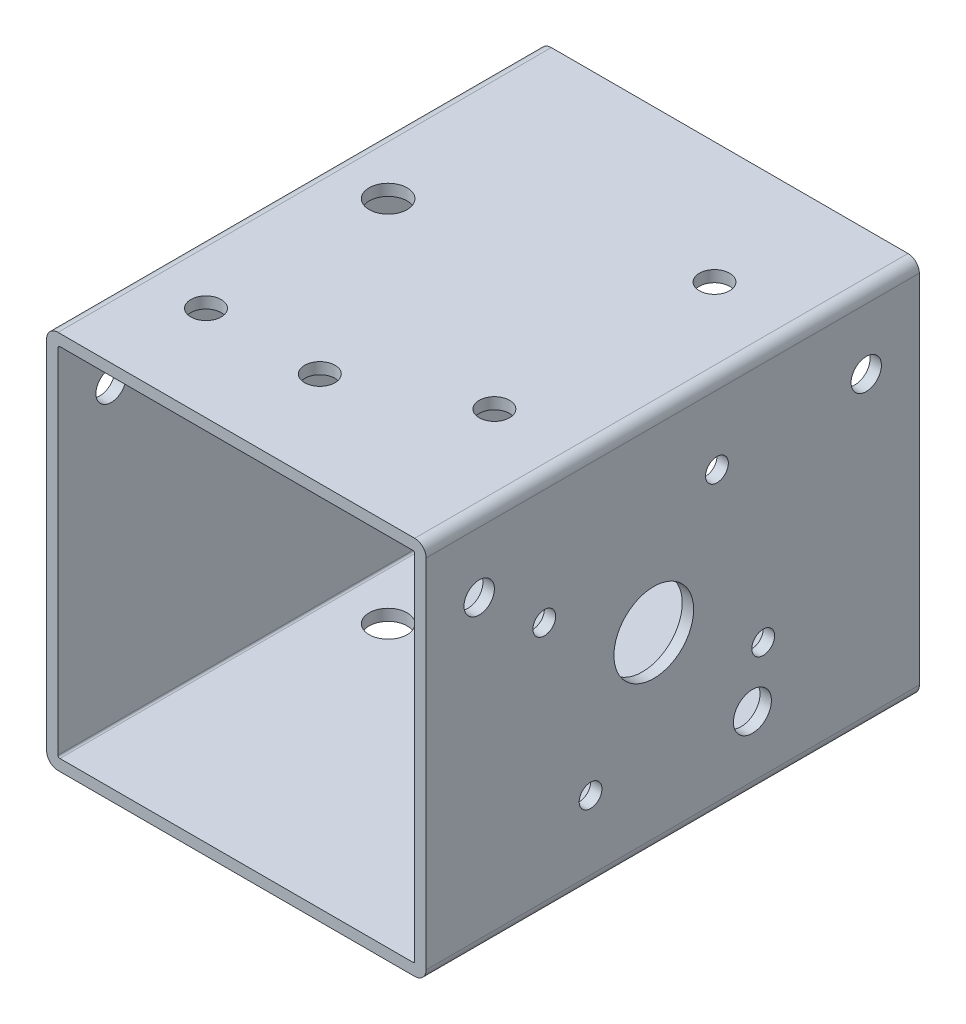
from build123d import *

# Parameters (mm, degrees)
SKETCH1_W                      = 100
SKETCH1_H                      = 100
SKETCH1_W_2                    = 94
SKETCH1_H_2                    = 94
EXTRUDE_THIN1_DEPTH            = 130
FILLET1_R                      = 0.5
FILLET2_R                      = 3
F_8_0_8_DIAMETER_HOLE2_D       = 8
F_8_0_8_DIAMETER_HOLE3_D       = 8
F_10_0_10_DIAMETER_HOLE1_D     = 10
F_10_0_10_DIAMETER_HOLE2_D     = 10
M8X1_25_TAPPED_HOLE1_D         = 6.8
M8X1_25_TAPPED_HOLE1_DEPTH     = 3
M8X1_25_TAPPED_HOLE2_D         = 6.8
M8X1_25_TAPPED_HOLE2_DEPTH     = 3
F_21_0_21_DIAMETER_HOLE1_D     = 21
F_21_0_21_DIAMETER_HOLE1_DEPTH = 3
F_6_0_6_DIAMETER_HOLE1_D       = 6
F_6_0_6_DIAMETER_HOLE1_DEPTH   = 3
F_8_0_8_DIAMETER_HOLE4_D       = 8
F_8_0_8_DIAMETER_HOLE4_DEPTH   = 3
SKETCH33_R                     = 4
CUT_EXTRUDE1_DEPTH             = 10


with BuildPart() as part:
    # Sketch1 → Extrude-Thin1 (new body)
    with BuildSketch(Plane.XY):
        Rectangle(SKETCH1_W, SKETCH1_H)
        Rectangle(SKETCH1_W_2, SKETCH1_H_2, mode=Mode.SUBTRACT)
    extrude(amount=EXTRUDE_THIN1_DEPTH)

    # Fillet1
    fillet1_edges = [part.edges().sort_by_distance(p)[0] for p in [
        (47, -47, 65),
        (47, 47, 65),
        (-47, 47, 65),
        (-47, -47, 65),
    ]]
    fillet(fillet1_edges, radius=FILLET1_R)

    # Fillet2
    fillet2_edges = [part.edges().sort_by_distance(p)[0] for p in [
        (50, -50, 65),
        (-50, -50, 65),
        (-50, 50, 65),
        (50, 50, 65),
    ]]
    fillet(fillet2_edges, radius=FILLET2_R)

    # Ø8.0 (8) Diameter Hole2 (through all)
    with Locations(Plane(origin=(0, 50, 0), x_dir=(1, 0, 0), z_dir=(0, 1, 0))):
        with Locations((28, -32), (28, -90)):
            Hole(F_8_0_8_DIAMETER_HOLE2_D / 2)

    # Ø8.0 (8) Diameter Hole3 (through all)
    with Locations(Plane(origin=(50, 0, 0), x_dir=(0, 0, -1), z_dir=(1, 0, 0))):
        with Locations((-14, 31), (-116, 31)):
            Hole(F_8_0_8_DIAMETER_HOLE3_D / 2)

    # Ø10.0 (10) Diameter Hole1 (through all)
    with Locations(Plane(origin=(0, 50, 0), x_dir=(1, 0, 0), z_dir=(0, 1, 0))):
        with Locations((-34, -56)):
            Hole(F_10_0_10_DIAMETER_HOLE1_D / 2)

    # Ø10.0 (10) Diameter Hole2 (through all)
    with Locations(Plane(origin=(50, 0, 0), x_dir=(0, 0, -1), z_dir=(1, 0, 0))):
        with Locations((-44, -31)):
            Hole(F_10_0_10_DIAMETER_HOLE2_D / 2)

    # M8x1.25 Tapped Hole1
    with Locations(Plane.ZY.offset(50)):
        with Locations((56, -15), (56, 35)):
            Hole(M8X1_25_TAPPED_HOLE1_D / 2, depth=M8X1_25_TAPPED_HOLE1_DEPTH)

    # M8x1.25 Tapped Hole2
    with Locations(Plane(origin=(0, -50, 0), x_dir=(-1, 0, 0), z_dir=(0, -1, 0))):
        with Locations((20, -44), (-35, -44)):
            Hole(M8X1_25_TAPPED_HOLE2_D / 2, depth=M8X1_25_TAPPED_HOLE2_DEPTH)

    # Ø21.0 (21) Diameter Hole1
    with Locations(Plane(origin=(50, 0, 0), x_dir=(0, 0, -1), z_dir=(1, 0, 0))):
        with Locations((-70, 0)):
            Hole(F_21_0_21_DIAMETER_HOLE1_D / 2, depth=F_21_0_21_DIAMETER_HOLE1_DEPTH)

    # Ø6.0 (6) Diameter Hole1
    with Locations(Plane(origin=(50, 0, 0), x_dir=(0, 0, -1), z_dir=(1, 0, 0))):
        with Locations((-41.157258279, -16.652364697), (-53.347635303, 28.842741721), (-98.842741721, 16.652364697), (-86.652364697, -28.842741721)):
            Hole(F_6_0_6_DIAMETER_HOLE1_D / 2, depth=F_6_0_6_DIAMETER_HOLE1_DEPTH)

    # Ø8.0 (8) Diameter Hole4
    with Locations(Plane(origin=(0, 50, 0), x_dir=(1, 0, 0), z_dir=(0, 1, 0))):
        with Locations((-3, -105)):
            Hole(F_8_0_8_DIAMETER_HOLE4_D / 2, depth=F_8_0_8_DIAMETER_HOLE4_DEPTH)

    # Sketch33 → Cut-Extrude1 (cut)
    with BuildSketch(Plane(origin=(0, 50, 0), x_dir=(1, 0, 0), z_dir=(0, 1, 0))):
        with Locations(Location((-33, -105, 0), (0, 0, 270))):
            Circle(SKETCH33_R)
    extrude(amount=-CUT_EXTRUDE1_DEPTH, mode=Mode.SUBTRACT)


solid = part.part
